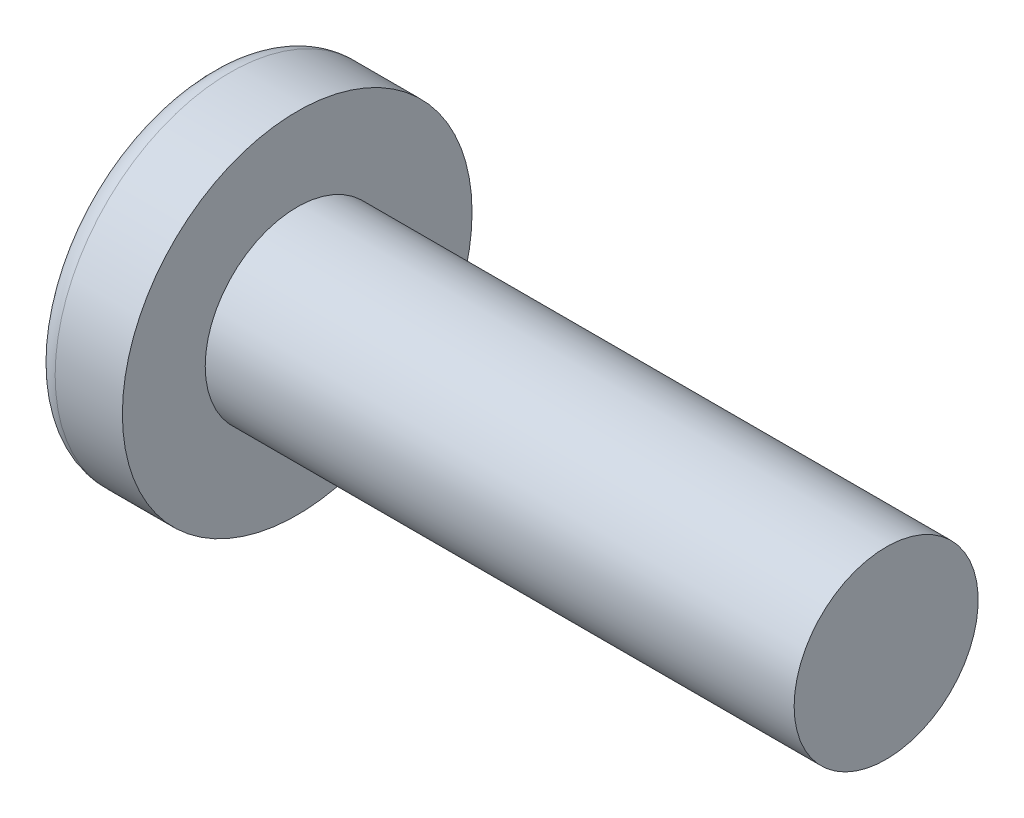
from build123d import *

# Parameters (mm, degrees)
CIRPATTERN1_COUNT = 2
CIRPATTERN1_ANGLE = 90


with BuildPart() as part:
    # BodySke → Base-Revolve (revolve)
    with BuildSketch(Plane.XY, mode=Mode.PRIVATE) as base_revolve_sk:
        with BuildLine():
            Line((3.7, 2.5), (3.7, 4.75))
            Line((3.7, 4.75), (1.873214546, 4.75))
            ThreePointArc((1.873214546, 4.75), (1.592049018, 4.680043343), (1.376448158, 4.486486486))
            ThreePointArc((1.376448158, 4.486486486), (0.351849415, 2.346442548), (0, 0))
            Line((0, 0), (19.7, 0))
            Line((19.7, 0), (19.7, 2.5))
            Line((19.7, 2.5), (3.7, 2.5))
        make_face()
    revolve(base_revolve_sk.sketch.rotate(Axis((-25.4, 0, 0), (1, 0, 0)), 90), axis=Axis((-25.4, 0, 0), (1, 0, 0)))

    # Sketch3 → Cut-Loft1 section 0
    with BuildSketch(Plane(origin=(0, 0, 0), x_dir=(0, 0, -1), z_dir=(1, 0, 0))):
        with BuildLine():
            Line((0.5, -2.45), (-0.5, -2.45))
            Line((-0.5, -2.45), (-0.5, 2.45))
            Line((-0.5, 2.45), (0.5, 2.45))
            Line((0.5, 2.45), (0.5, -2.45))
        make_face()
    # Sketch4 → Cut-Loft1 section 1
    with BuildSketch(Plane(origin=(2.95, 0, 0), x_dir=(0, 0, -1), z_dir=(1, 0, 0))):
        with BuildLine():
            Line((0.25, -0.25), (-0.25, -0.25))
            Line((-0.25, -0.25), (-0.25, 0.25))
            Line((-0.25, 0.25), (0.25, 0.25))
            Line((0.25, 0.25), (0.25, -0.25))
        make_face()
    cut_loft1 = loft(mode=Mode.SUBTRACT)

    # CirPattern1: Cut-Loft1 ×2 about axis
    cirpattern1_axis = Axis((0, 0, 0), (1, 0, 0))
    for i in range(1, CIRPATTERN1_COUNT):
        add(cut_loft1.rotate(cirpattern1_axis, i * CIRPATTERN1_ANGLE / (CIRPATTERN1_COUNT - 1)), mode=Mode.SUBTRACT)


solid = part.part
